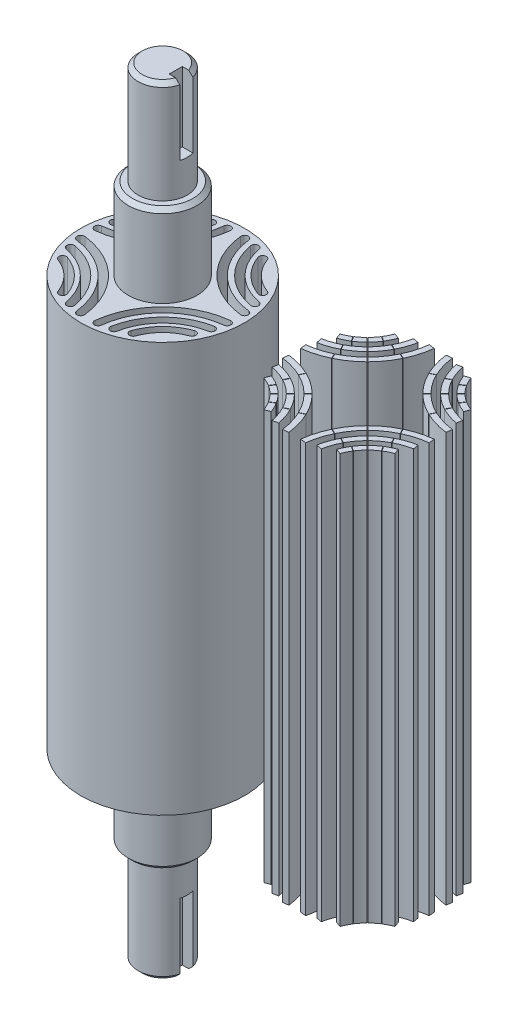
from build123d import *

# Parameters (mm, degrees)
SKETCH_1_R          = 20
EXTRUDE_1_DEPTH     = 50
SKETCH_3_R          = 8.4
EXTRUDE_2_DEPTH     = 20
SKETCH_4_R          = 6
EXTRUDE_3_DEPTH     = 25
CHAMFER_1_SIZE      = 1
CHAMFER_2_SIZE      = 1
SKETCH_5_W          = 3.2
SKETCH_5_H          = 32
CUT_EXTRUDE_1_DEPTH = 6.8
CUT_EXTRUDE_2_REACH = 101.121
EXTRUDE_4_DEPTH     = 100
EXTRUDE_4_2_DEPTH   = 100
EXTRUDE_4_3_DEPTH   = 100
EXTRUDE_4_4_DEPTH   = 100
EXTRUDE_4_5_DEPTH   = 100
EXTRUDE_4_6_DEPTH   = 100
EXTRUDE_4_7_DEPTH   = 100
EXTRUDE_4_8_DEPTH   = 100
EXTRUDE_4_9_DEPTH   = 100
EXTRUDE_4_10_DEPTH  = 100
EXTRUDE_4_11_DEPTH  = 100
EXTRUDE_4_12_DEPTH  = 100
EXTRUDE_4_13_DEPTH  = 100
EXTRUDE_4_14_DEPTH  = 100
EXTRUDE_4_15_DEPTH  = 100
EXTRUDE_4_16_DEPTH  = 100
EXTRUDE_4_17_DEPTH  = 100
EXTRUDE_4_18_DEPTH  = 100
EXTRUDE_4_19_DEPTH  = 100
EXTRUDE_4_20_DEPTH  = 100
EXTRUDE_4_21_DEPTH  = 100
EXTRUDE_4_22_DEPTH  = 100
EXTRUDE_4_23_DEPTH  = 100
EXTRUDE_4_24_DEPTH  = 100
EXTRUDE_4_25_DEPTH  = 100
EXTRUDE_4_26_DEPTH  = 100
EXTRUDE_4_27_DEPTH  = 100
EXTRUDE_4_28_DEPTH  = 100
EXTRUDE_4_29_DEPTH  = 100
EXTRUDE_4_30_DEPTH  = 100
EXTRUDE_4_31_DEPTH  = 100
EXTRUDE_4_32_DEPTH  = 100
EXTRUDE_4_33_DEPTH  = 100
EXTRUDE_4_34_DEPTH  = 100
EXTRUDE_4_35_DEPTH  = 100
EXTRUDE_4_36_DEPTH  = 100
EXTRUDE_4_37_DEPTH  = 100
EXTRUDE_4_38_DEPTH  = 100
EXTRUDE_4_39_DEPTH  = 100
EXTRUDE_4_40_DEPTH  = 100
EXTRUDE_4_41_DEPTH  = 100
EXTRUDE_4_42_DEPTH  = 100
EXTRUDE_4_43_DEPTH  = 100
EXTRUDE_4_44_DEPTH  = 100
EXTRUDE_4_45_DEPTH  = 100
EXTRUDE_4_46_DEPTH  = 100
EXTRUDE_4_47_DEPTH  = 100
EXTRUDE_4_48_DEPTH  = 100


with BuildPart() as part:
    # 草图1 → 凸台-拉伸1 (new body)
    with BuildSketch(Plane(origin=(0, 0, 0), x_dir=(1, 0, 0), z_dir=(0, 1, 0))):
        with Locations(Location((0, 0, 0), (0, 0, 270))):
            Circle(SKETCH_1_R)
    extrude(amount=EXTRUDE_1_DEPTH)

    # 草图3 → 凸台-拉伸2 (add)
    with BuildSketch(Plane(origin=(0, 50, 0), x_dir=(1, 0, 0), z_dir=(0, 1, 0))):
        with Locations(Location((0, 0, 0), (0, 0, 270))):
            Circle(SKETCH_3_R)
    extrude(amount=EXTRUDE_2_DEPTH)

    # 草图4 → 凸台-拉伸3 (add)
    with BuildSketch(Plane(origin=(0, 70, 0), x_dir=(1, 0, 0), z_dir=(0, 1, 0))):
        with Locations(Location((0, 0, 0), (0, 0, 270))):
            Circle(SKETCH_4_R)
    extrude(amount=EXTRUDE_3_DEPTH)

    # 倒角1
    chamfer_1_edges = [part.edges().sort_by_distance(p)[0] for p in [
        (0, 70, -8.4),
    ]]
    chamfer(chamfer_1_edges, length=CHAMFER_1_SIZE)

    # 倒角2
    chamfer_2_edges = [part.edges().sort_by_distance(p)[0] for p in [
        (0, 95, -6),
    ]]
    chamfer(chamfer_2_edges, length=CHAMFER_2_SIZE)

    # 草图5 → 切除-拉伸1 (cut)
    with BuildSketch(Plane(origin=(10, 0, 0), x_dir=(0, 0, -1), z_dir=(1, 0, 0))):
        with Locations((0, 94)):
            Rectangle(SKETCH_5_W, SKETCH_5_H)
    extrude(amount=-CUT_EXTRUDE_1_DEPTH, mode=Mode.SUBTRACT)

    # 草图6 → 切除-拉伸2 (cut, up to next)
    with BuildSketch(Plane.XZ, mode=Mode.PRIVATE) as cut_extrude_2_sk1:
        with BuildLine():
            ThreePointArc((1.231760179, 17.772276736), (6.613127617, 6.613127617), (17.772276736, 1.231760179))
            ThreePointArc((17.772276736, 1.231760179), (18.768239821, 2.024260988), (17.975739012, 3.020224073))
            ThreePointArc((17.975739012, 3.020224073), (7.885919824, 7.885919824), (3.020224073, 17.975739012))
            ThreePointArc((3.020224073, 17.975739012), (2.024260988, 18.768239821), (1.231760179, 17.772276736))
        make_face()
    cut_extrude_2_tool1 = extrude(cut_extrude_2_sk1.sketch, amount=-CUT_EXTRUDE_2_REACH, mode=Mode.PRIVATE) & part.part
    # 草图6 → 切除-拉伸2 (cut, up to next)
    with BuildSketch(Plane.XZ, mode=Mode.PRIVATE) as cut_extrude_2_sk2:
        with BuildLine():
            ThreePointArc((4.433377005, 17.032513665), (8.776290321, 8.776290321), (17.032513665, 4.433377005))
            ThreePointArc((17.032513665, 4.433377005), (18.081332495, 5.154472743), (17.360236757, 6.203291572))
            ThreePointArc((17.360236757, 6.203291572), (10.049082528, 10.049082528), (6.203291572, 17.360236757))
            ThreePointArc((6.203291572, 17.360236757), (5.154472743, 18.081332495), (4.433377005, 17.032513665))
        make_face()
    cut_extrude_2_tool2 = extrude(cut_extrude_2_sk2.sketch, amount=-CUT_EXTRUDE_2_REACH, mode=Mode.PRIVATE) & part.part
    # 草图6 → 切除-拉伸2 (cut, up to next)
    with BuildSketch(Plane.XZ, mode=Mode.PRIVATE) as cut_extrude_2_sk3:
        with BuildLine():
            ThreePointArc((7.768200635, 15.498070825), (10.773859642, 10.773859642), (15.498070825, 7.768200635))
            ThreePointArc((15.498070825, 7.768200635), (16.650964042, 8.307493904), (16.111670773, 9.460387121))
            ThreePointArc((16.111670773, 9.460387121), (12.046651848, 12.046651848), (9.460387121, 16.111670773))
            ThreePointArc((9.460387121, 16.111670773), (8.307493904, 16.650964042), (7.768200635, 15.498070825))
        make_face()
    cut_extrude_2_tool3 = extrude(cut_extrude_2_sk3.sketch, amount=-CUT_EXTRUDE_2_REACH, mode=Mode.PRIVATE) & part.part
    # 草图6 → 切除-拉伸2 (cut, up to next)
    with BuildSketch(Plane.XZ, mode=Mode.PRIVATE) as cut_extrude_2_sk4:
        with BuildLine():
            ThreePointArc((17.772276736, -1.231760179), (6.613127617, -6.613127617), (1.231760179, -17.772276736))
            ThreePointArc((1.231760179, -17.772276736), (2.024260988, -18.768239821), (3.020224073, -17.975739012))
            ThreePointArc((3.020224073, -17.975739012), (7.885919824, -7.885919824), (17.975739012, -3.020224073))
            ThreePointArc((17.975739012, -3.020224073), (18.768239821, -2.024260988), (17.772276736, -1.231760179))
        make_face()
    cut_extrude_2_tool4 = extrude(cut_extrude_2_sk4.sketch, amount=-CUT_EXTRUDE_2_REACH, mode=Mode.PRIVATE) & part.part
    # 草图6 → 切除-拉伸2 (cut, up to next)
    with BuildSketch(Plane.XZ, mode=Mode.PRIVATE) as cut_extrude_2_sk5:
        with BuildLine():
            ThreePointArc((17.032513665, -4.433377005), (8.776290321, -8.776290321), (4.433377005, -17.032513665))
            ThreePointArc((4.433377005, -17.032513665), (5.154472743, -18.081332495), (6.203291572, -17.360236757))
            ThreePointArc((6.203291572, -17.360236757), (10.049082528, -10.049082528), (17.360236757, -6.203291572))
            ThreePointArc((17.360236757, -6.203291572), (18.081332495, -5.154472743), (17.032513665, -4.433377005))
        make_face()
    cut_extrude_2_tool5 = extrude(cut_extrude_2_sk5.sketch, amount=-CUT_EXTRUDE_2_REACH, mode=Mode.PRIVATE) & part.part
    # 草图6 → 切除-拉伸2 (cut, up to next)
    with BuildSketch(Plane.XZ, mode=Mode.PRIVATE) as cut_extrude_2_sk6:
        with BuildLine():
            ThreePointArc((15.498070825, -7.768200635), (10.773859642, -10.773859642), (7.768200635, -15.498070825))
            ThreePointArc((7.768200635, -15.498070825), (8.307493904, -16.650964042), (9.460387121, -16.111670773))
            ThreePointArc((9.460387121, -16.111670773), (12.046651848, -12.046651848), (16.111670773, -9.460387121))
            ThreePointArc((16.111670773, -9.460387121), (16.650964042, -8.307493904), (15.498070825, -7.768200635))
        make_face()
    cut_extrude_2_tool6 = extrude(cut_extrude_2_sk6.sketch, amount=-CUT_EXTRUDE_2_REACH, mode=Mode.PRIVATE) & part.part
    # 草图6 → 切除-拉伸2 (cut, up to next)
    with BuildSketch(Plane.XZ, mode=Mode.PRIVATE) as cut_extrude_2_sk7:
        with BuildLine():
            ThreePointArc((-1.231760179, -17.772276736), (-6.613127617, -6.613127617), (-17.772276736, -1.231760179))
            ThreePointArc((-17.772276736, -1.231760179), (-18.768239821, -2.024260988), (-17.975739012, -3.020224073))
            ThreePointArc((-17.975739012, -3.020224073), (-7.885919824, -7.885919824), (-3.020224073, -17.975739012))
            ThreePointArc((-3.020224073, -17.975739012), (-2.024260988, -18.768239821), (-1.231760179, -17.772276736))
        make_face()
    cut_extrude_2_tool7 = extrude(cut_extrude_2_sk7.sketch, amount=-CUT_EXTRUDE_2_REACH, mode=Mode.PRIVATE) & part.part
    # 草图6 → 切除-拉伸2 (cut, up to next)
    with BuildSketch(Plane.XZ, mode=Mode.PRIVATE) as cut_extrude_2_sk8:
        with BuildLine():
            ThreePointArc((-4.433377005, -17.032513665), (-8.776290321, -8.776290321), (-17.032513665, -4.433377005))
            ThreePointArc((-17.032513665, -4.433377005), (-18.081332495, -5.154472743), (-17.360236757, -6.203291572))
            ThreePointArc((-17.360236757, -6.203291572), (-10.049082528, -10.049082528), (-6.203291572, -17.360236757))
            ThreePointArc((-6.203291572, -17.360236757), (-5.154472743, -18.081332495), (-4.433377005, -17.032513665))
        make_face()
    cut_extrude_2_tool8 = extrude(cut_extrude_2_sk8.sketch, amount=-CUT_EXTRUDE_2_REACH, mode=Mode.PRIVATE) & part.part
    # 草图6 → 切除-拉伸2 (cut, up to next)
    with BuildSketch(Plane.XZ, mode=Mode.PRIVATE) as cut_extrude_2_sk9:
        with BuildLine():
            ThreePointArc((-7.768200635, -15.498070825), (-10.773859642, -10.773859642), (-15.498070825, -7.768200635))
            ThreePointArc((-15.498070825, -7.768200635), (-16.650964042, -8.307493904), (-16.111670773, -9.460387121))
            ThreePointArc((-16.111670773, -9.460387121), (-12.046651848, -12.046651848), (-9.460387121, -16.111670773))
            ThreePointArc((-9.460387121, -16.111670773), (-8.307493904, -16.650964042), (-7.768200635, -15.498070825))
        make_face()
    cut_extrude_2_tool9 = extrude(cut_extrude_2_sk9.sketch, amount=-CUT_EXTRUDE_2_REACH, mode=Mode.PRIVATE) & part.part
    # 草图6 → 切除-拉伸2 (cut, up to next)
    with BuildSketch(Plane.XZ, mode=Mode.PRIVATE) as cut_extrude_2_sk10:
        with BuildLine():
            ThreePointArc((-17.772276736, 1.231760179), (-6.613127617, 6.613127617), (-1.231760179, 17.772276736))
            ThreePointArc((-1.231760179, 17.772276736), (-2.024260988, 18.768239821), (-3.020224073, 17.975739012))
            ThreePointArc((-3.020224073, 17.975739012), (-7.885919824, 7.885919824), (-17.975739012, 3.020224073))
            ThreePointArc((-17.975739012, 3.020224073), (-18.768239821, 2.024260988), (-17.772276736, 1.231760179))
        make_face()
    cut_extrude_2_tool10 = extrude(cut_extrude_2_sk10.sketch, amount=-CUT_EXTRUDE_2_REACH, mode=Mode.PRIVATE) & part.part
    # 草图6 → 切除-拉伸2 (cut, up to next)
    with BuildSketch(Plane.XZ, mode=Mode.PRIVATE) as cut_extrude_2_sk11:
        with BuildLine():
            ThreePointArc((-17.032513665, 4.433377005), (-8.776290321, 8.776290321), (-4.433377005, 17.032513665))
            ThreePointArc((-4.433377005, 17.032513665), (-5.154472743, 18.081332495), (-6.203291572, 17.360236757))
            ThreePointArc((-6.203291572, 17.360236757), (-10.049082528, 10.049082528), (-17.360236757, 6.203291572))
            ThreePointArc((-17.360236757, 6.203291572), (-18.081332495, 5.154472743), (-17.032513665, 4.433377005))
        make_face()
    cut_extrude_2_tool11 = extrude(cut_extrude_2_sk11.sketch, amount=-CUT_EXTRUDE_2_REACH, mode=Mode.PRIVATE) & part.part
    # 草图6 → 切除-拉伸2 (cut, up to next)
    with BuildSketch(Plane.XZ, mode=Mode.PRIVATE) as cut_extrude_2_sk12:
        with BuildLine():
            ThreePointArc((-15.498070825, 7.768200635), (-10.773859642, 10.773859642), (-7.768200635, 15.498070825))
            ThreePointArc((-7.768200635, 15.498070825), (-8.307493904, 16.650964042), (-9.460387121, 16.111670773))
            ThreePointArc((-9.460387121, 16.111670773), (-12.046651848, 12.046651848), (-16.111670773, 9.460387121))
            ThreePointArc((-16.111670773, 9.460387121), (-16.650964042, 8.307493904), (-15.498070825, 7.768200635))
        make_face()
    cut_extrude_2_tool12 = extrude(cut_extrude_2_sk12.sketch, amount=-CUT_EXTRUDE_2_REACH, mode=Mode.PRIVATE) & part.part
    add(cut_extrude_2_tool1.solids().sort_by_distance((18.521664, 0, 2.052312))[0], mode=Mode.SUBTRACT)
    add(cut_extrude_2_tool2.solids().sort_by_distance((9.912302, 0, 9.912302))[0], mode=Mode.SUBTRACT)
    add(cut_extrude_2_tool3.solids().sort_by_distance((11.741436, 0, 11.741436))[0], mode=Mode.SUBTRACT)
    add(cut_extrude_2_tool4.solids().sort_by_distance((7.71044, 0, -7.71044))[0], mode=Mode.SUBTRACT)
    add(cut_extrude_2_tool5.solids().sort_by_distance((17.891129, 0, -5.189691))[0], mode=Mode.SUBTRACT)
    add(cut_extrude_2_tool6.solids().sort_by_distance((11.741436, 0, -11.741436))[0], mode=Mode.SUBTRACT)
    add(cut_extrude_2_tool7.solids().sort_by_distance((-7.71044, 0, -7.71044))[0], mode=Mode.SUBTRACT)
    add(cut_extrude_2_tool8.solids().sort_by_distance((-8.913071, 0, -8.913071))[0], mode=Mode.SUBTRACT)
    add(cut_extrude_2_tool9.solids().sort_by_distance((-11.741436, 0, -11.741436))[0], mode=Mode.SUBTRACT)
    add(cut_extrude_2_tool10.solids().sort_by_distance((-18.521664, 0, 2.052312))[0], mode=Mode.SUBTRACT)
    add(cut_extrude_2_tool11.solids().sort_by_distance((-8.913071, 0, 8.913071))[0], mode=Mode.SUBTRACT)
    add(cut_extrude_2_tool12.solids().sort_by_distance((-11.741436, 0, 11.741436))[0], mode=Mode.SUBTRACT)

    # 镜向1: part across plane


with BuildPart() as part_1:
    add(part.part)
    add(part.part.mirror(Plane.ZX))


with BuildPart() as body_2:
    # 草图8 → 凸台-拉伸4 (new body)
    with BuildSketch(Plane(origin=(0, 50, 0), x_dir=(1, 0, 0), z_dir=(0, 1, 0))):
        with BuildLine():
            Line((11.869875153, 11.940585831), (10.879925659, 10.950636337))
            ThreePointArc((10.879925659, 10.950636337), (9.988875267, 11.944600386), (9.211330738, 13.029662521))
            Line((9.211330738, 13.029662521), (10.392078762, 13.781881972))
            ThreePointArc((10.392078762, 13.781881972), (11.080713544, 12.820893247), (11.869875153, 11.940585831))
        make_face()
    extrude(amount=-EXTRUDE_4_DEPTH)


with BuildPart() as body_3:
    # 草图8 → Extrude 4 2 (new body)
    with BuildSketch(Plane(origin=(0, 50, 0), x_dir=(1, 0, 0), z_dir=(0, 1, 0))):
        with BuildLine():
            Line((10.33842402, 13.866269037), (9.157600777, 13.114001665))
            ThreePointArc((9.157600777, 13.114001665), (8.501854027, 14.285313207), (7.973358296, 15.51927706))
            Line((7.973358296, 15.51927706), (9.287614229, 16.001699429))
            ThreePointArc((9.287614229, 16.001699429), (9.756647507, 14.906244697), (10.33842402, 13.866269037))
        make_face()
    extrude(amount=-EXTRUDE_4_2_DEPTH)


with BuildPart() as body_4:
    # 草图8 → Extrude 4 3 (new body)
    with BuildSketch(Plane(origin=(0, 50, 0), x_dir=(1, 0, 0), z_dir=(0, 1, 0))):
        with BuildLine():
            Line((6.014988916, 17.27910568), (4.639216756, 17.019777771))
            ThreePointArc((4.639216756, 17.019777771), (5.226982676, 14.810319148), (6.132832504, 12.711125904))
            Line((6.132832504, 12.711125904), (7.371815196, 13.362986232))
            ThreePointArc((7.371815196, 13.362986232), (6.549010057, 15.271018151), (6.014988916, 17.27910568))
        make_face()
    extrude(amount=-EXTRUDE_4_3_DEPTH)


with BuildPart() as body_5:
    # 草图8 → Extrude 4 4 (new body)
    with BuildSketch(Plane(origin=(0, 50, 0), x_dir=(1, 0, 0), z_dir=(0, 1, 0))):
        with BuildLine():
            Line((7.418376648, 13.274487469), (6.179393956, 12.62262714))
            ThreePointArc((6.179393956, 12.62262714), (7.392514785, 10.685932178), (8.882356339, 8.953067017))
            Line((8.882356339, 8.953067017), (9.872305832, 9.94301651))
            ThreePointArc((9.872305832, 9.94301651), (8.519728493, 11.516226858), (7.418376648, 13.274487469))
        make_face()
    extrude(amount=-EXTRUDE_4_4_DEPTH)


with BuildPart() as body_6:
    # 草图8 → Extrude 4 5 (new body)
    with BuildSketch(Plane(origin=(0, 50, 0), x_dir=(1, 0, 0), z_dir=(0, 1, 0))):
        with BuildLine():
            Line((7.709143128, 7.779853806), (6.719193635, 6.789904313))
            ThreePointArc((6.719193635, 6.789904313), (4.738940459, 9.134254753), (3.178535896, 11.776700443))
            Line((3.178535896, 11.776700443), (4.439513431, 12.384923803))
            ThreePointArc((4.439513431, 12.384923803), (5.880473127, 9.944750384), (7.709143128, 7.779853806))
        make_face()
    extrude(amount=-EXTRUDE_4_5_DEPTH)


with BuildPart() as body_7:
    # 草图8 → Extrude 4 6 (new body)
    with BuildSketch(Plane(origin=(0, 50, 0), x_dir=(1, 0, 0), z_dir=(0, 1, 0))):
        with BuildLine():
            Line((4.396068905, 12.474993627), (3.13509137, 11.866770267))
            ThreePointArc((3.13509137, 11.866770267), (2.042057116, 14.735593325), (1.436196944, 17.745211751))
            Line((1.436196944, 17.745211751), (2.826793622, 17.907202119))
            ThreePointArc((2.826793622, 17.907202119), (3.38648732, 15.126115284), (4.396068905, 12.474993627))
        make_face()
    extrude(amount=-EXTRUDE_4_6_DEPTH)


with BuildPart() as body_8:
    # 草图8 → Extrude 4 7 (new body)
    with BuildSketch(Plane(origin=(0, 50, 0), x_dir=(1, 0, 0), z_dir=(0, 1, 0))):
        with BuildLine():
            Line((11.940585831, -11.869875153), (10.950636337, -10.879925659))
            ThreePointArc((10.950636337, -10.879925659), (11.944600386, -9.988875267), (13.029662521, -9.211330738))
            Line((13.029662521, -9.211330738), (13.781881972, -10.392078762))
            ThreePointArc((13.781881972, -10.392078762), (12.820893247, -11.080713544), (11.940585831, -11.869875153))
        make_face()
    extrude(amount=-EXTRUDE_4_7_DEPTH)


with BuildPart() as body_9:
    # 草图8 → Extrude 4 8 (new body)
    with BuildSketch(Plane(origin=(0, 50, 0), x_dir=(1, 0, 0), z_dir=(0, 1, 0))):
        with BuildLine():
            Line((17.907202119, 2.826793622), (17.745211751, 1.436196944))
            ThreePointArc((17.745211751, 1.436196944), (14.735593325, 2.042057116), (11.866770267, 3.13509137))
            Line((11.866770267, 3.13509137), (12.474993627, 4.396068905))
            ThreePointArc((12.474993627, 4.396068905), (15.126115284, 3.38648732), (17.907202119, 2.826793622))
        make_face()
    extrude(amount=-EXTRUDE_4_8_DEPTH)


with BuildPart() as body_10:
    # 草图8 → Extrude 4 9 (new body)
    with BuildSketch(Plane(origin=(0, 50, 0), x_dir=(1, 0, 0), z_dir=(0, 1, 0))):
        with BuildLine():
            Line((12.384923803, 4.439513431), (11.776700443, 3.178535896))
            ThreePointArc((11.776700443, 3.178535896), (9.134254753, 4.738940459), (6.789904313, 6.719193635))
            Line((6.789904313, 6.719193635), (7.779853806, 7.709143128))
            ThreePointArc((7.779853806, 7.709143128), (9.944750384, 5.880473127), (12.384923803, 4.439513431))
        make_face()
    extrude(amount=-EXTRUDE_4_9_DEPTH)


with BuildPart() as body_11:
    # 草图8 → Extrude 4 10 (new body)
    with BuildSketch(Plane(origin=(0, 50, 0), x_dir=(1, 0, 0), z_dir=(0, 1, 0))):
        with BuildLine():
            Line((9.94301651, 9.872305832), (8.953067017, 8.882356339))
            ThreePointArc((8.953067017, 8.882356339), (10.685932178, 7.392514785), (12.62262714, 6.179393956))
            Line((12.62262714, 6.179393956), (13.274487469, 7.418376648))
            ThreePointArc((13.274487469, 7.418376648), (11.516226858, 8.519728493), (9.94301651, 9.872305832))
        make_face()
    extrude(amount=-EXTRUDE_4_10_DEPTH)


with BuildPart() as body_12:
    # 草图8 → Extrude 4 11 (new body)
    with BuildSketch(Plane(origin=(0, 50, 0), x_dir=(1, 0, 0), z_dir=(0, 1, 0))):
        with BuildLine():
            Line((13.362986232, 7.371815196), (12.711125904, 6.132832504))
            ThreePointArc((12.711125904, 6.132832504), (14.810319148, 5.226982676), (17.019777771, 4.639216756))
            Line((17.019777771, 4.639216756), (17.27910568, 6.014988916))
            ThreePointArc((17.27910568, 6.014988916), (15.271018151, 6.549010057), (13.362986232, 7.371815196))
        make_face()
    extrude(amount=-EXTRUDE_4_11_DEPTH)


with BuildPart() as body_13:
    # 草图8 → Extrude 4 12 (new body)
    with BuildSketch(Plane(origin=(0, 50, 0), x_dir=(1, 0, 0), z_dir=(0, 1, 0))):
        with BuildLine():
            Line((16.001699429, 9.287614229), (15.51927706, 7.973358296))
            ThreePointArc((15.51927706, 7.973358296), (14.285313207, 8.501854027), (13.114001665, 9.157600777))
            Line((13.114001665, 9.157600777), (13.866269037, 10.33842402))
            ThreePointArc((13.866269037, 10.33842402), (14.906244697, 9.756647507), (16.001699429, 9.287614229))
        make_face()
    extrude(amount=-EXTRUDE_4_12_DEPTH)


with BuildPart() as body_14:
    # 草图8 → Extrude 4 13 (new body)
    with BuildSketch(Plane(origin=(0, 50, 0), x_dir=(1, 0, 0), z_dir=(0, 1, 0))):
        with BuildLine():
            Line((13.781881972, 10.392078762), (13.029662521, 9.211330738))
            ThreePointArc((13.029662521, 9.211330738), (11.944600386, 9.988875267), (10.950636337, 10.879925659))
            Line((10.950636337, 10.879925659), (11.940585831, 11.869875153))
            ThreePointArc((11.940585831, 11.869875153), (12.820893247, 11.080713544), (13.781881972, 10.392078762))
        make_face()
    extrude(amount=-EXTRUDE_4_13_DEPTH)


with BuildPart() as body_15:
    # 草图8 → Extrude 4 14 (new body)
    with BuildSketch(Plane(origin=(0, 50, 0), x_dir=(1, 0, 0), z_dir=(0, 1, 0))):
        with BuildLine():
            Line((13.866269037, -10.33842402), (13.114001665, -9.157600777))
            ThreePointArc((13.114001665, -9.157600777), (14.285313207, -8.501854027), (15.51927706, -7.973358296))
            Line((15.51927706, -7.973358296), (16.001699429, -9.287614229))
            ThreePointArc((16.001699429, -9.287614229), (14.906244697, -9.756647507), (13.866269037, -10.33842402))
        make_face()
    extrude(amount=-EXTRUDE_4_14_DEPTH)


with BuildPart() as body_16:
    # 草图8 → Extrude 4 15 (new body)
    with BuildSketch(Plane(origin=(0, 50, 0), x_dir=(1, 0, 0), z_dir=(0, 1, 0))):
        with BuildLine():
            Line((17.27910568, -6.014988916), (17.019777771, -4.639216756))
            ThreePointArc((17.019777771, -4.639216756), (14.810319148, -5.226982676), (12.711125904, -6.132832504))
            Line((12.711125904, -6.132832504), (13.362986232, -7.371815196))
            ThreePointArc((13.362986232, -7.371815196), (15.271018151, -6.549010057), (17.27910568, -6.014988916))
        make_face()
    extrude(amount=-EXTRUDE_4_15_DEPTH)


with BuildPart() as body_17:
    # 草图8 → Extrude 4 16 (new body)
    with BuildSketch(Plane(origin=(0, 50, 0), x_dir=(1, 0, 0), z_dir=(0, 1, 0))):
        with BuildLine():
            Line((13.274487469, -7.418376648), (12.62262714, -6.179393956))
            ThreePointArc((12.62262714, -6.179393956), (10.685932178, -7.392514785), (8.953067017, -8.882356339))
            Line((8.953067017, -8.882356339), (9.94301651, -9.872305832))
            ThreePointArc((9.94301651, -9.872305832), (11.516226858, -8.519728493), (13.274487469, -7.418376648))
        make_face()
    extrude(amount=-EXTRUDE_4_16_DEPTH)


with BuildPart() as body_18:
    # 草图8 → Extrude 4 17 (new body)
    with BuildSketch(Plane(origin=(0, 50, 0), x_dir=(1, 0, 0), z_dir=(0, 1, 0))):
        with BuildLine():
            Line((7.779853806, -7.709143128), (6.789904313, -6.719193635))
            ThreePointArc((6.789904313, -6.719193635), (9.134254753, -4.738940459), (11.776700443, -3.178535896))
            Line((11.776700443, -3.178535896), (12.384923803, -4.439513431))
            ThreePointArc((12.384923803, -4.439513431), (9.944750384, -5.880473127), (7.779853806, -7.709143128))
        make_face()
    extrude(amount=-EXTRUDE_4_17_DEPTH)


with BuildPart() as body_19:
    # 草图8 → Extrude 4 18 (new body)
    with BuildSketch(Plane(origin=(0, 50, 0), x_dir=(1, 0, 0), z_dir=(0, 1, 0))):
        with BuildLine():
            Line((12.474993627, -4.396068905), (11.866770267, -3.13509137))
            ThreePointArc((11.866770267, -3.13509137), (14.735593325, -2.042057116), (17.745211751, -1.436196944))
            Line((17.745211751, -1.436196944), (17.907202119, -2.826793622))
            ThreePointArc((17.907202119, -2.826793622), (15.126115284, -3.38648732), (12.474993627, -4.396068905))
        make_face()
    extrude(amount=-EXTRUDE_4_18_DEPTH)


with BuildPart() as body_20:
    # 草图8 → Extrude 4 19 (new body)
    with BuildSketch(Plane(origin=(0, 50, 0), x_dir=(1, 0, 0), z_dir=(0, 1, 0))):
        with BuildLine():
            Line((2.826793622, -17.907202119), (1.436196944, -17.745211751))
            ThreePointArc((1.436196944, -17.745211751), (2.042057116, -14.735593325), (3.13509137, -11.866770267))
            Line((3.13509137, -11.866770267), (4.396068905, -12.474993627))
            ThreePointArc((4.396068905, -12.474993627), (3.38648732, -15.126115284), (2.826793622, -17.907202119))
        make_face()
    extrude(amount=-EXTRUDE_4_19_DEPTH)


with BuildPart() as body_21:
    # 草图8 → Extrude 4 20 (new body)
    with BuildSketch(Plane(origin=(0, 50, 0), x_dir=(1, 0, 0), z_dir=(0, 1, 0))):
        with BuildLine():
            Line((4.439513431, -12.384923803), (3.178535896, -11.776700443))
            ThreePointArc((3.178535896, -11.776700443), (4.738940459, -9.134254753), (6.719193635, -6.789904313))
            Line((6.719193635, -6.789904313), (7.709143128, -7.779853806))
            ThreePointArc((7.709143128, -7.779853806), (5.880473127, -9.944750384), (4.439513431, -12.384923803))
        make_face()
    extrude(amount=-EXTRUDE_4_20_DEPTH)


with BuildPart() as body_22:
    # 草图8 → Extrude 4 21 (new body)
    with BuildSketch(Plane(origin=(0, 50, 0), x_dir=(1, 0, 0), z_dir=(0, 1, 0))):
        with BuildLine():
            Line((9.872305832, -9.94301651), (8.882356339, -8.953067017))
            ThreePointArc((8.882356339, -8.953067017), (7.392514785, -10.685932178), (6.179393956, -12.62262714))
            Line((6.179393956, -12.62262714), (7.418376648, -13.274487469))
            ThreePointArc((7.418376648, -13.274487469), (8.519728493, -11.516226858), (9.872305832, -9.94301651))
        make_face()
    extrude(amount=-EXTRUDE_4_21_DEPTH)


with BuildPart() as body_23:
    # 草图8 → Extrude 4 22 (new body)
    with BuildSketch(Plane(origin=(0, 50, 0), x_dir=(1, 0, 0), z_dir=(0, 1, 0))):
        with BuildLine():
            Line((7.371815196, -13.362986232), (6.132832504, -12.711125904))
            ThreePointArc((6.132832504, -12.711125904), (5.226982676, -14.810319148), (4.639216756, -17.019777771))
            Line((4.639216756, -17.019777771), (6.014988916, -17.27910568))
            ThreePointArc((6.014988916, -17.27910568), (6.549010057, -15.271018151), (7.371815196, -13.362986232))
        make_face()
    extrude(amount=-EXTRUDE_4_22_DEPTH)


with BuildPart() as body_24:
    # 草图8 → Extrude 4 23 (new body)
    with BuildSketch(Plane(origin=(0, 50, 0), x_dir=(1, 0, 0), z_dir=(0, 1, 0))):
        with BuildLine():
            Line((9.287614229, -16.001699429), (7.973358296, -15.51927706))
            ThreePointArc((7.973358296, -15.51927706), (8.501854027, -14.285313207), (9.157600777, -13.114001665))
            Line((9.157600777, -13.114001665), (10.33842402, -13.866269037))
            ThreePointArc((10.33842402, -13.866269037), (9.756647507, -14.906244697), (9.287614229, -16.001699429))
        make_face()
    extrude(amount=-EXTRUDE_4_23_DEPTH)


with BuildPart() as body_25:
    # 草图8 → Extrude 4 24 (new body)
    with BuildSketch(Plane(origin=(0, 50, 0), x_dir=(1, 0, 0), z_dir=(0, 1, 0))):
        with BuildLine():
            Line((10.392078762, -13.781881972), (9.211330738, -13.029662521))
            ThreePointArc((9.211330738, -13.029662521), (9.988875267, -11.944600386), (10.879925659, -10.950636337))
            Line((10.879925659, -10.950636337), (11.869875153, -11.940585831))
            ThreePointArc((11.869875153, -11.940585831), (11.080713544, -12.820893247), (10.392078762, -13.781881972))
        make_face()
    extrude(amount=-EXTRUDE_4_24_DEPTH)


with BuildPart() as body_26:
    # 草图8 → Extrude 4 25 (new body)
    with BuildSketch(Plane(origin=(0, 50, 0), x_dir=(1, 0, 0), z_dir=(0, 1, 0))):
        with BuildLine():
            Line((-11.869875153, -11.940585831), (-10.879925659, -10.950636337))
            ThreePointArc((-10.879925659, -10.950636337), (-9.988875267, -11.944600386), (-9.211330738, -13.029662521))
            Line((-9.211330738, -13.029662521), (-10.392078762, -13.781881972))
            ThreePointArc((-10.392078762, -13.781881972), (-11.080713544, -12.820893247), (-11.869875153, -11.940585831))
        make_face()
    extrude(amount=-EXTRUDE_4_25_DEPTH)


with BuildPart() as body_27:
    # 草图8 → Extrude 4 26 (new body)
    with BuildSketch(Plane(origin=(0, 50, 0), x_dir=(1, 0, 0), z_dir=(0, 1, 0))):
        with BuildLine():
            Line((-10.33842402, -13.866269037), (-9.157600777, -13.114001665))
            ThreePointArc((-9.157600777, -13.114001665), (-8.501854027, -14.285313207), (-7.973358296, -15.51927706))
            Line((-7.973358296, -15.51927706), (-9.287614229, -16.001699429))
            ThreePointArc((-9.287614229, -16.001699429), (-9.756647507, -14.906244697), (-10.33842402, -13.866269037))
        make_face()
    extrude(amount=-EXTRUDE_4_26_DEPTH)


with BuildPart() as body_28:
    # 草图8 → Extrude 4 27 (new body)
    with BuildSketch(Plane(origin=(0, 50, 0), x_dir=(1, 0, 0), z_dir=(0, 1, 0))):
        with BuildLine():
            Line((-6.014988916, -17.27910568), (-4.639216756, -17.019777771))
            ThreePointArc((-4.639216756, -17.019777771), (-5.226982676, -14.810319148), (-6.132832504, -12.711125904))
            Line((-6.132832504, -12.711125904), (-7.371815196, -13.362986232))
            ThreePointArc((-7.371815196, -13.362986232), (-6.549010057, -15.271018151), (-6.014988916, -17.27910568))
        make_face()
    extrude(amount=-EXTRUDE_4_27_DEPTH)


with BuildPart() as body_29:
    # 草图8 → Extrude 4 28 (new body)
    with BuildSketch(Plane(origin=(0, 50, 0), x_dir=(1, 0, 0), z_dir=(0, 1, 0))):
        with BuildLine():
            Line((-7.418376648, -13.274487469), (-6.179393956, -12.62262714))
            ThreePointArc((-6.179393956, -12.62262714), (-7.392514785, -10.685932178), (-8.882356339, -8.953067017))
            Line((-8.882356339, -8.953067017), (-9.872305832, -9.94301651))
            ThreePointArc((-9.872305832, -9.94301651), (-8.519728493, -11.516226858), (-7.418376648, -13.274487469))
        make_face()
    extrude(amount=-EXTRUDE_4_28_DEPTH)


with BuildPart() as body_30:
    # 草图8 → Extrude 4 29 (new body)
    with BuildSketch(Plane(origin=(0, 50, 0), x_dir=(1, 0, 0), z_dir=(0, 1, 0))):
        with BuildLine():
            Line((-7.709143128, -7.779853806), (-6.719193635, -6.789904313))
            ThreePointArc((-6.719193635, -6.789904313), (-4.738940459, -9.134254753), (-3.178535896, -11.776700443))
            Line((-3.178535896, -11.776700443), (-4.439513431, -12.384923803))
            ThreePointArc((-4.439513431, -12.384923803), (-5.880473127, -9.944750384), (-7.709143128, -7.779853806))
        make_face()
    extrude(amount=-EXTRUDE_4_29_DEPTH)


with BuildPart() as body_31:
    # 草图8 → Extrude 4 30 (new body)
    with BuildSketch(Plane(origin=(0, 50, 0), x_dir=(1, 0, 0), z_dir=(0, 1, 0))):
        with BuildLine():
            Line((-4.396068905, -12.474993627), (-3.13509137, -11.866770267))
            ThreePointArc((-3.13509137, -11.866770267), (-2.042057116, -14.735593325), (-1.436196944, -17.745211751))
            Line((-1.436196944, -17.745211751), (-2.826793622, -17.907202119))
            ThreePointArc((-2.826793622, -17.907202119), (-3.38648732, -15.126115284), (-4.396068905, -12.474993627))
        make_face()
    extrude(amount=-EXTRUDE_4_30_DEPTH)


with BuildPart() as body_32:
    # 草图8 → Extrude 4 31 (new body)
    with BuildSketch(Plane(origin=(0, 50, 0), x_dir=(1, 0, 0), z_dir=(0, 1, 0))):
        with BuildLine():
            Line((-17.907202119, -2.826793622), (-17.745211751, -1.436196944))
            ThreePointArc((-17.745211751, -1.436196944), (-14.735593325, -2.042057116), (-11.866770267, -3.13509137))
            Line((-11.866770267, -3.13509137), (-12.474993627, -4.396068905))
            ThreePointArc((-12.474993627, -4.396068905), (-15.126115284, -3.38648732), (-17.907202119, -2.826793622))
        make_face()
    extrude(amount=-EXTRUDE_4_31_DEPTH)


with BuildPart() as body_33:
    # 草图8 → Extrude 4 32 (new body)
    with BuildSketch(Plane(origin=(0, 50, 0), x_dir=(1, 0, 0), z_dir=(0, 1, 0))):
        with BuildLine():
            Line((-12.384923803, -4.439513431), (-11.776700443, -3.178535896))
            ThreePointArc((-11.776700443, -3.178535896), (-9.134254753, -4.738940459), (-6.789904313, -6.719193635))
            Line((-6.789904313, -6.719193635), (-7.779853806, -7.709143128))
            ThreePointArc((-7.779853806, -7.709143128), (-9.944750384, -5.880473127), (-12.384923803, -4.439513431))
        make_face()
    extrude(amount=-EXTRUDE_4_32_DEPTH)


with BuildPart() as body_34:
    # 草图8 → Extrude 4 33 (new body)
    with BuildSketch(Plane(origin=(0, 50, 0), x_dir=(1, 0, 0), z_dir=(0, 1, 0))):
        with BuildLine():
            Line((-9.94301651, -9.872305832), (-8.953067017, -8.882356339))
            ThreePointArc((-8.953067017, -8.882356339), (-10.685932178, -7.392514785), (-12.62262714, -6.179393956))
            Line((-12.62262714, -6.179393956), (-13.274487469, -7.418376648))
            ThreePointArc((-13.274487469, -7.418376648), (-11.516226858, -8.519728493), (-9.94301651, -9.872305832))
        make_face()
    extrude(amount=-EXTRUDE_4_33_DEPTH)


with BuildPart() as body_35:
    # 草图8 → Extrude 4 34 (new body)
    with BuildSketch(Plane(origin=(0, 50, 0), x_dir=(1, 0, 0), z_dir=(0, 1, 0))):
        with BuildLine():
            Line((-13.362986232, -7.371815196), (-12.711125904, -6.132832504))
            ThreePointArc((-12.711125904, -6.132832504), (-14.810319148, -5.226982676), (-17.019777771, -4.639216756))
            Line((-17.019777771, -4.639216756), (-17.27910568, -6.014988916))
            ThreePointArc((-17.27910568, -6.014988916), (-15.271018151, -6.549010057), (-13.362986232, -7.371815196))
        make_face()
    extrude(amount=-EXTRUDE_4_34_DEPTH)


with BuildPart() as body_36:
    # 草图8 → Extrude 4 35 (new body)
    with BuildSketch(Plane(origin=(0, 50, 0), x_dir=(1, 0, 0), z_dir=(0, 1, 0))):
        with BuildLine():
            Line((-16.001699429, -9.287614229), (-15.51927706, -7.973358296))
            ThreePointArc((-15.51927706, -7.973358296), (-14.285313207, -8.501854027), (-13.114001665, -9.157600777))
            Line((-13.114001665, -9.157600777), (-13.866269037, -10.33842402))
            ThreePointArc((-13.866269037, -10.33842402), (-14.906244697, -9.756647507), (-16.001699429, -9.287614229))
        make_face()
    extrude(amount=-EXTRUDE_4_35_DEPTH)


with BuildPart() as body_37:
    # 草图8 → Extrude 4 36 (new body)
    with BuildSketch(Plane(origin=(0, 50, 0), x_dir=(1, 0, 0), z_dir=(0, 1, 0))):
        with BuildLine():
            Line((-13.781881972, -10.392078762), (-13.029662521, -9.211330738))
            ThreePointArc((-13.029662521, -9.211330738), (-11.944600386, -9.988875267), (-10.950636337, -10.879925659))
            Line((-10.950636337, -10.879925659), (-11.940585831, -11.869875153))
            ThreePointArc((-11.940585831, -11.869875153), (-12.820893247, -11.080713544), (-13.781881972, -10.392078762))
        make_face()
    extrude(amount=-EXTRUDE_4_36_DEPTH)


with BuildPart() as body_38:
    # 草图8 → Extrude 4 37 (new body)
    with BuildSketch(Plane(origin=(0, 50, 0), x_dir=(1, 0, 0), z_dir=(0, 1, 0))):
        with BuildLine():
            Line((-11.940585831, 11.869875153), (-10.950636337, 10.879925659))
            ThreePointArc((-10.950636337, 10.879925659), (-11.944600386, 9.988875267), (-13.029662521, 9.211330738))
            Line((-13.029662521, 9.211330738), (-13.781881972, 10.392078762))
            ThreePointArc((-13.781881972, 10.392078762), (-12.820893247, 11.080713544), (-11.940585831, 11.869875153))
        make_face()
    extrude(amount=-EXTRUDE_4_37_DEPTH)


with BuildPart() as body_39:
    # 草图8 → Extrude 4 38 (new body)
    with BuildSketch(Plane(origin=(0, 50, 0), x_dir=(1, 0, 0), z_dir=(0, 1, 0))):
        with BuildLine():
            Line((-13.866269037, 10.33842402), (-13.114001665, 9.157600777))
            ThreePointArc((-13.114001665, 9.157600777), (-14.285313207, 8.501854027), (-15.51927706, 7.973358296))
            Line((-15.51927706, 7.973358296), (-16.001699429, 9.287614229))
            ThreePointArc((-16.001699429, 9.287614229), (-14.906244697, 9.756647507), (-13.866269037, 10.33842402))
        make_face()
    extrude(amount=-EXTRUDE_4_38_DEPTH)


with BuildPart() as body_40:
    # 草图8 → Extrude 4 39 (new body)
    with BuildSketch(Plane(origin=(0, 50, 0), x_dir=(1, 0, 0), z_dir=(0, 1, 0))):
        with BuildLine():
            Line((-17.27910568, 6.014988916), (-17.019777771, 4.639216756))
            ThreePointArc((-17.019777771, 4.639216756), (-14.810319148, 5.226982676), (-12.711125904, 6.132832504))
            Line((-12.711125904, 6.132832504), (-13.362986232, 7.371815196))
            ThreePointArc((-13.362986232, 7.371815196), (-15.271018151, 6.549010057), (-17.27910568, 6.014988916))
        make_face()
    extrude(amount=-EXTRUDE_4_39_DEPTH)


with BuildPart() as body_41:
    # 草图8 → Extrude 4 40 (new body)
    with BuildSketch(Plane(origin=(0, 50, 0), x_dir=(1, 0, 0), z_dir=(0, 1, 0))):
        with BuildLine():
            Line((-13.274487469, 7.418376648), (-12.62262714, 6.179393956))
            ThreePointArc((-12.62262714, 6.179393956), (-10.685932178, 7.392514785), (-8.953067017, 8.882356339))
            Line((-8.953067017, 8.882356339), (-9.94301651, 9.872305832))
            ThreePointArc((-9.94301651, 9.872305832), (-11.516226858, 8.519728493), (-13.274487469, 7.418376648))
        make_face()
    extrude(amount=-EXTRUDE_4_40_DEPTH)


with BuildPart() as body_42:
    # 草图8 → Extrude 4 41 (new body)
    with BuildSketch(Plane(origin=(0, 50, 0), x_dir=(1, 0, 0), z_dir=(0, 1, 0))):
        with BuildLine():
            Line((-7.779853806, 7.709143128), (-6.789904313, 6.719193635))
            ThreePointArc((-6.789904313, 6.719193635), (-9.134254753, 4.738940459), (-11.776700443, 3.178535896))
            Line((-11.776700443, 3.178535896), (-12.384923803, 4.439513431))
            ThreePointArc((-12.384923803, 4.439513431), (-9.944750384, 5.880473127), (-7.779853806, 7.709143128))
        make_face()
    extrude(amount=-EXTRUDE_4_41_DEPTH)


with BuildPart() as body_43:
    # 草图8 → Extrude 4 42 (new body)
    with BuildSketch(Plane(origin=(0, 50, 0), x_dir=(1, 0, 0), z_dir=(0, 1, 0))):
        with BuildLine():
            Line((-12.474993627, 4.396068905), (-11.866770267, 3.13509137))
            ThreePointArc((-11.866770267, 3.13509137), (-14.735593325, 2.042057116), (-17.745211751, 1.436196944))
            Line((-17.745211751, 1.436196944), (-17.907202119, 2.826793622))
            ThreePointArc((-17.907202119, 2.826793622), (-15.126115284, 3.38648732), (-12.474993627, 4.396068905))
        make_face()
    extrude(amount=-EXTRUDE_4_42_DEPTH)


with BuildPart() as body_44:
    # 草图8 → Extrude 4 43 (new body)
    with BuildSketch(Plane(origin=(0, 50, 0), x_dir=(1, 0, 0), z_dir=(0, 1, 0))):
        with BuildLine():
            Line((-2.826793622, 17.907202119), (-1.436196944, 17.745211751))
            ThreePointArc((-1.436196944, 17.745211751), (-2.042057116, 14.735593325), (-3.13509137, 11.866770267))
            Line((-3.13509137, 11.866770267), (-4.396068905, 12.474993627))
            ThreePointArc((-4.396068905, 12.474993627), (-3.38648732, 15.126115284), (-2.826793622, 17.907202119))
        make_face()
    extrude(amount=-EXTRUDE_4_43_DEPTH)


with BuildPart() as body_45:
    # 草图8 → Extrude 4 44 (new body)
    with BuildSketch(Plane(origin=(0, 50, 0), x_dir=(1, 0, 0), z_dir=(0, 1, 0))):
        with BuildLine():
            Line((-4.439513431, 12.384923803), (-3.178535896, 11.776700443))
            ThreePointArc((-3.178535896, 11.776700443), (-4.738940459, 9.134254753), (-6.719193635, 6.789904313))
            Line((-6.719193635, 6.789904313), (-7.709143128, 7.779853806))
            ThreePointArc((-7.709143128, 7.779853806), (-5.880473127, 9.944750384), (-4.439513431, 12.384923803))
        make_face()
    extrude(amount=-EXTRUDE_4_44_DEPTH)


with BuildPart() as body_46:
    # 草图8 → Extrude 4 45 (new body)
    with BuildSketch(Plane(origin=(0, 50, 0), x_dir=(1, 0, 0), z_dir=(0, 1, 0))):
        with BuildLine():
            Line((-9.872305832, 9.94301651), (-8.882356339, 8.953067017))
            ThreePointArc((-8.882356339, 8.953067017), (-7.392514785, 10.685932178), (-6.179393956, 12.62262714))
            Line((-6.179393956, 12.62262714), (-7.418376648, 13.274487469))
            ThreePointArc((-7.418376648, 13.274487469), (-8.519728493, 11.516226858), (-9.872305832, 9.94301651))
        make_face()
    extrude(amount=-EXTRUDE_4_45_DEPTH)


with BuildPart() as body_47:
    # 草图8 → Extrude 4 46 (new body)
    with BuildSketch(Plane(origin=(0, 50, 0), x_dir=(1, 0, 0), z_dir=(0, 1, 0))):
        with BuildLine():
            Line((-7.371815196, 13.362986232), (-6.132832504, 12.711125904))
            ThreePointArc((-6.132832504, 12.711125904), (-5.226982676, 14.810319148), (-4.639216756, 17.019777771))
            Line((-4.639216756, 17.019777771), (-6.014988916, 17.27910568))
            ThreePointArc((-6.014988916, 17.27910568), (-6.549010057, 15.271018151), (-7.371815196, 13.362986232))
        make_face()
    extrude(amount=-EXTRUDE_4_46_DEPTH)


with BuildPart() as body_48:
    # 草图8 → Extrude 4 47 (new body)
    with BuildSketch(Plane(origin=(0, 50, 0), x_dir=(1, 0, 0), z_dir=(0, 1, 0))):
        with BuildLine():
            Line((-9.287614229, 16.001699429), (-7.973358296, 15.51927706))
            ThreePointArc((-7.973358296, 15.51927706), (-8.501854027, 14.285313207), (-9.157600777, 13.114001665))
            Line((-9.157600777, 13.114001665), (-10.33842402, 13.866269037))
            ThreePointArc((-10.33842402, 13.866269037), (-9.756647507, 14.906244697), (-9.287614229, 16.001699429))
        make_face()
    extrude(amount=-EXTRUDE_4_47_DEPTH)


with BuildPart() as body_49:
    # 草图8 → Extrude 4 48 (new body)
    with BuildSketch(Plane(origin=(0, 50, 0), x_dir=(1, 0, 0), z_dir=(0, 1, 0))):
        with BuildLine():
            Line((-10.392078762, 13.781881972), (-9.211330738, 13.029662521))
            ThreePointArc((-9.211330738, 13.029662521), (-9.988875267, 11.944600386), (-10.879925659, 10.950636337))
            Line((-10.879925659, 10.950636337), (-11.869875153, 11.940585831))
            ThreePointArc((-11.869875153, 11.940585831), (-11.080713544, 12.820893247), (-10.392078762, 13.781881972))
        make_face()
    extrude(amount=-EXTRUDE_4_48_DEPTH)


with BuildPart() as body_48_1:
    # Move Body 1: moved
    add(body_48.part.moved(Location((50, 0, 0))))


with BuildPart() as body_49_1:
    # Move Body 1: moved
    add(body_49.part.moved(Location((50, 0, 0))))


with BuildPart() as body_38_1:
    # Move Body 1: moved
    add(body_38.part.moved(Location((50, 0, 0))))


with BuildPart() as body_39_1:
    # Move Body 1: moved
    add(body_39.part.moved(Location((50, 0, 0))))


with BuildPart() as body_40_1:
    # Move Body 1: moved
    add(body_40.part.moved(Location((50, 0, 0))))


with BuildPart() as body_41_1:
    # Move Body 1: moved
    add(body_41.part.moved(Location((50, 0, 0))))


with BuildPart() as body_46_1:
    # Move Body 1: moved
    add(body_46.part.moved(Location((50, 0, 0))))


with BuildPart() as body_47_1:
    # Move Body 1: moved
    add(body_47.part.moved(Location((50, 0, 0))))


with BuildPart() as body_44_1:
    # Move Body 1: moved
    add(body_44.part.moved(Location((50, 0, 0))))


with BuildPart() as body_45_1:
    # Move Body 1: moved
    add(body_45.part.moved(Location((50, 0, 0))))


with BuildPart() as body_42_1:
    # Move Body 1: moved
    add(body_42.part.moved(Location((50, 0, 0))))


with BuildPart() as body_43_1:
    # Move Body 1: moved
    add(body_43.part.moved(Location((50, 0, 0))))


with BuildPart() as body_7_1:
    # Move Body 1: moved
    add(body_7.part.moved(Location((50, 0, 0))))


with BuildPart() as body_6_1:
    # Move Body 1: moved
    add(body_6.part.moved(Location((50, 0, 0))))


with BuildPart() as body_10_1:
    # Move Body 1: moved
    add(body_10.part.moved(Location((50, 0, 0))))


with BuildPart() as body_9_1:
    # Move Body 1: moved
    add(body_9.part.moved(Location((50, 0, 0))))


with BuildPart() as body_12_1:
    # Move Body 1: moved
    add(body_12.part.moved(Location((50, 0, 0))))


with BuildPart() as body_11_1:
    # Move Body 1: moved
    add(body_11.part.moved(Location((50, 0, 0))))


with BuildPart() as body_5_1:
    # Move Body 1: moved
    add(body_5.part.moved(Location((50, 0, 0))))


with BuildPart() as body_4_1:
    # Move Body 1: moved
    add(body_4.part.moved(Location((50, 0, 0))))


with BuildPart() as body_3_1:
    # Move Body 1: moved
    add(body_3.part.moved(Location((50, 0, 0))))


with BuildPart() as body_2_1:
    # Move Body 1: moved
    add(body_2.part.moved(Location((50, 0, 0))))


with BuildPart() as body_14_1:
    # Move Body 1: moved
    add(body_14.part.moved(Location((50, 0, 0))))


with BuildPart() as body_13_1:
    # Move Body 1: moved
    add(body_13.part.moved(Location((50, 0, 0))))


with BuildPart() as body_19_1:
    # Move Body 1: moved
    add(body_19.part.moved(Location((50, 0, 0))))


with BuildPart() as body_18_1:
    # Move Body 1: moved
    add(body_18.part.moved(Location((50, 0, 0))))


with BuildPart() as body_21_1:
    # Move Body 1: moved
    add(body_21.part.moved(Location((50, 0, 0))))


with BuildPart() as body_20_1:
    # Move Body 1: moved
    add(body_20.part.moved(Location((50, 0, 0))))


with BuildPart() as body_23_1:
    # Move Body 1: moved
    add(body_23.part.moved(Location((50, 0, 0))))


with BuildPart() as body_22_1:
    # Move Body 1: moved
    add(body_22.part.moved(Location((50, 0, 0))))


with BuildPart() as body_17_1:
    # Move Body 1: moved
    add(body_17.part.moved(Location((50, 0, 0))))


with BuildPart() as body_16_1:
    # Move Body 1: moved
    add(body_16.part.moved(Location((50, 0, 0))))


with BuildPart() as body_15_1:
    # Move Body 1: moved
    add(body_15.part.moved(Location((50, 0, 0))))


with BuildPart() as body_8_1:
    # Move Body 1: moved
    add(body_8.part.moved(Location((50, 0, 0))))


with BuildPart() as body_25_1:
    # Move Body 1: moved
    add(body_25.part.moved(Location((50, 0, 0))))


with BuildPart() as body_24_1:
    # Move Body 1: moved
    add(body_24.part.moved(Location((50, 0, 0))))


with BuildPart() as body_27_1:
    # Move Body 1: moved
    add(body_27.part.moved(Location((50, 0, 0))))


with BuildPart() as body_26_1:
    # Move Body 1: moved
    add(body_26.part.moved(Location((50, 0, 0))))


with BuildPart() as body_37_1:
    # Move Body 1: moved
    add(body_37.part.moved(Location((50, 0, 0))))


with BuildPart() as body_36_1:
    # Move Body 1: moved
    add(body_36.part.moved(Location((50, 0, 0))))


with BuildPart() as body_35_1:
    # Move Body 1: moved
    add(body_35.part.moved(Location((50, 0, 0))))


with BuildPart() as body_32_1:
    # Move Body 1: moved
    add(body_32.part.moved(Location((50, 0, 0))))


with BuildPart() as body_33_1:
    # Move Body 1: moved
    add(body_33.part.moved(Location((50, 0, 0))))


with BuildPart() as body_34_1:
    # Move Body 1: moved
    add(body_34.part.moved(Location((50, 0, 0))))


with BuildPart() as body_30_1:
    # Move Body 1: moved
    add(body_30.part.moved(Location((50, 0, 0))))


with BuildPart() as body_29_1:
    # Move Body 1: moved
    add(body_29.part.moved(Location((50, 0, 0))))


with BuildPart() as body_28_1:
    # Move Body 1: moved
    add(body_28.part.moved(Location((50, 0, 0))))


with BuildPart() as body_31_1:
    # Move Body 1: moved
    add(body_31.part.moved(Location((50, 0, 0))))


solid = Compound([part_1.part, body_48_1.part, body_49_1.part, body_38_1.part, body_39_1.part, body_40_1.part, body_41_1.part, body_46_1.part, body_47_1.part, body_44_1.part, body_45_1.part, body_42_1.part, body_43_1.part, body_7_1.part, body_6_1.part, body_10_1.part, body_9_1.part, body_12_1.part, body_11_1.part, body_5_1.part, body_4_1.part, body_3_1.part, body_2_1.part, body_14_1.part, body_13_1.part, body_19_1.part, body_18_1.part, body_21_1.part, body_20_1.part, body_23_1.part, body_22_1.part, body_17_1.part, body_16_1.part, body_15_1.part, body_8_1.part, body_25_1.part, body_24_1.part, body_27_1.part, body_26_1.part, body_37_1.part, body_36_1.part, body_35_1.part, body_32_1.part, body_33_1.part, body_34_1.part, body_30_1.part, body_29_1.part, body_28_1.part, body_31_1.part])
